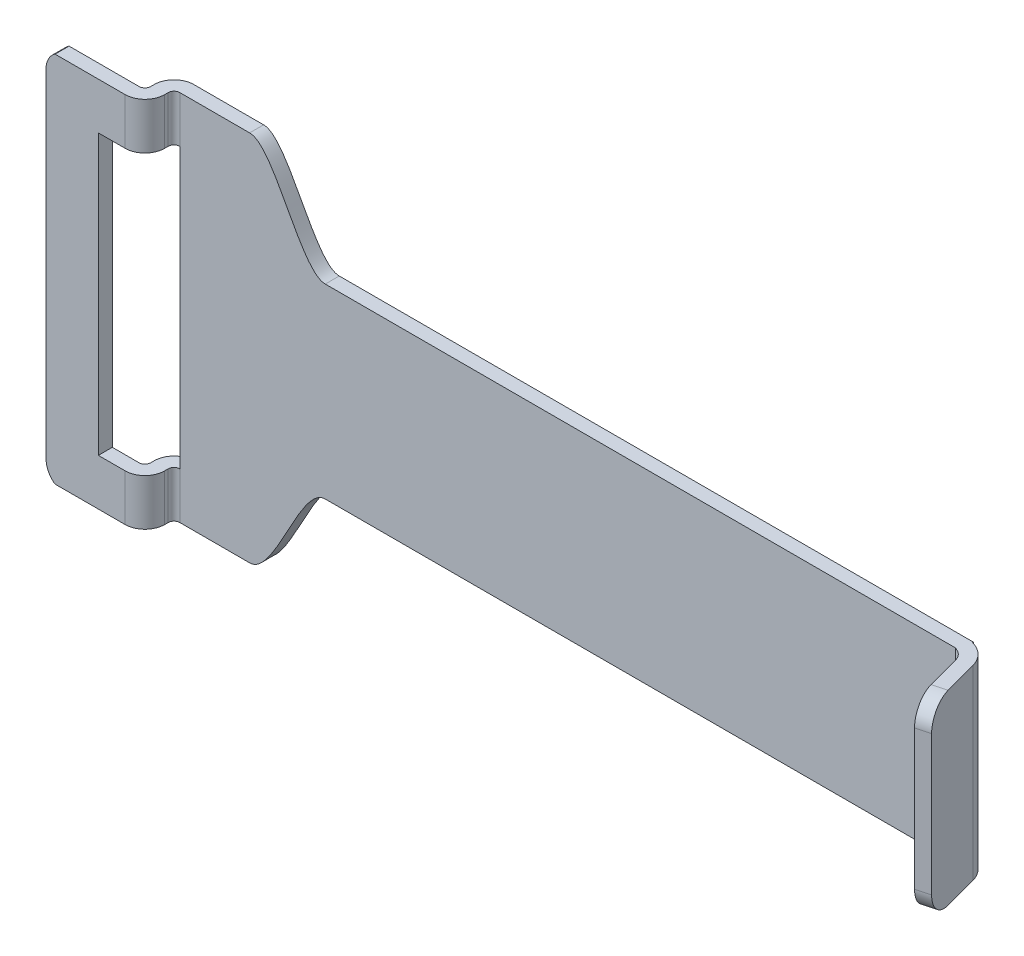
from build123d import *

# Parameters (mm, degrees)
EXTRUDE_1_2_DEPTH    = 1.2
EXTRUDE_16_DEPTH     = 16
EXTRUDE_32_DEPTH     = 32
SKETCH_24_138_5_W    = 4.5
SKETCH_24_138_5_H    = 24
CUT_EXTRUDE_24_DEPTH = 20
EXTRUDE_884_DEPTH    = 1.2
FILLET_R2_R          = 2


with BuildPart() as part:
    # 草图_平板外形_总宽32_舌宽16_对称过渡 → 拉伸_板厚1点2 (new body)
    with BuildSketch(Plane.XY.offset(-306.8)):
        with BuildLine():
            Line((-3.5, 122.5), (2.5, 122.5))
            add(Edge.make_bspline(
                [(2.5, 122.5), (2.568251017, 122.504680022), (2.707904652, 122.514256172), (2.913789315, 122.58691144), (3.117968932, 122.696636373), (3.321081083, 122.844952736), (3.523655529, 123.027402997), (3.725998426, 123.241623536), (3.928269446, 123.484685473), (4.130543205, 123.753813901), (4.33285106, 124.046152711), (4.53520279, 124.358837958), (4.737597952, 124.688983876), (4.940031434, 125.033693923), (5.142496177, 125.390062896), (5.344984435, 125.755180133), (5.547488324, 126.126131323), (5.75, 126.5), (5.952511676, 126.873868677), (6.155015565, 127.244819867), (6.357503823, 127.609937104), (6.559968566, 127.966306077), (6.762402048, 128.311016124), (6.96479721, 128.641162042), (7.16714894, 128.953847289), (7.369456795, 129.246186099), (7.571730554, 129.515314527), (7.774001574, 129.758376464), (7.976344471, 129.972597003), (8.178918917, 130.155047264), (8.382031068, 130.303363627), (8.586210685, 130.41308856), (8.792095348, 130.485743828), (8.931748983, 130.495319978), (9, 130.5)],
                knots=[0, 0, 0, 0, 0.019229913, 0.039347798, 0.060985216, 0.084517213, 0.110120649, 0.137834401, 0.167605027, 0.199317689, 0.232816328, 0.26791678, 0.304415434, 0.342095061, 0.380728864, 0.420083383, 0.459920669, 0.5, 0.540079331, 0.579916617, 0.619271136, 0.657904939, 0.695584566, 0.73208322, 0.767183672, 0.800682311, 0.832394973, 0.862165599, 0.889879351, 0.915482787, 0.939014784, 0.960652202, 0.980770087, 1, 1, 1, 1], degree=3))
            Line((9, 130.5), (63.2, 130.5))
            Line((63.2, 130.5), (63.2, 146.5))
            Line((63.2, 146.5), (9, 146.5))
            add(Edge.make_bspline(
                [(2.5, 154.5), (2.568251017, 154.495319978), (2.707904652, 154.485743828), (2.913789315, 154.41308856), (3.117968932, 154.303363627), (3.321081083, 154.155047264), (3.523655529, 153.972597003), (3.725998426, 153.758376464), (3.928269446, 153.515314527), (4.130543205, 153.246186099), (4.33285106, 152.953847289), (4.53520279, 152.641162042), (4.737597952, 152.311016124), (4.940031434, 151.966306077), (5.142496177, 151.609937104), (5.344984435, 151.244819867), (5.547488324, 150.873868677), (5.75, 150.5), (5.952511676, 150.126131323), (6.155015565, 149.755180133), (6.357503823, 149.390062896), (6.559968566, 149.033693923), (6.762402048, 148.688983876), (6.96479721, 148.358837958), (7.16714894, 148.046152711), (7.369456795, 147.753813901), (7.571730554, 147.484685473), (7.774001574, 147.241623536), (7.976344471, 147.027402997), (8.178918917, 146.844952736), (8.382031068, 146.696636373), (8.586210685, 146.58691144), (8.792095348, 146.514256172), (8.931748983, 146.504680022), (9, 146.5)],
                knots=[0, 0, 0, 0, 0.019229913, 0.039347798, 0.060985216, 0.084517213, 0.110120649, 0.137834401, 0.167605027, 0.199317689, 0.232816328, 0.26791678, 0.304415434, 0.342095061, 0.380728864, 0.420083383, 0.459920669, 0.5, 0.540079331, 0.579916617, 0.619271136, 0.657904939, 0.695584566, 0.73208322, 0.767183672, 0.800682311, 0.832394973, 0.862165599, 0.889879351, 0.915482787, 0.939014784, 0.960652202, 0.980770087, 1, 1, 1, 1], degree=3))
            Line((2.5, 154.5), (-3.5, 154.5))
            Line((-3.5, 154.5), (-3.5, 122.5))
        make_face()
    extrude(amount=EXTRUDE_1_2_DEPTH)

    # Sketch 429 → 拉伸_舌宽16 (add)
    with BuildSketch(Plane(origin=(0, 130.5, 0), x_dir=(1, 0, 0), z_dir=(0, 1, 0))):
        with BuildLine():
            Line((9, 306.8), (63.5, 306.8))
            Line((63.5, 306.8), (63.5, 306.723790008))
            ThreePointArc((63.5, 306.723790008), (64.58930082, 306.104776448), (65.218221983, 305.021165708))
            Line((65.218221983, 305.021165708), (66.512317209, 300.191536577))
            Line((66.512317209, 300.191536577), (65.353206217, 299.880953723))
            Line((65.353206217, 299.880953723), (64.059110992, 304.710582854))
            ThreePointArc((64.059110992, 304.710582854), (63.74465041, 305.252388224), (63.2, 305.561895004))
            Line((63.2, 305.561895004), (63.2, 305.6))
            Line((63.2, 305.6), (9, 305.6))
            Line((9, 305.6), (9, 306.8))
        make_face()
    extrude(amount=EXTRUDE_16_DEPTH)

    # Sketch 524 → 拉伸_头部总宽32 (add)
    with BuildSketch(Plane(origin=(0, 122.5, 0), x_dir=(1, 0, 0), z_dir=(0, 1, 0))):
        with BuildLine():
            Line((-5.7, 304.3), (-11.71944631, 304.3))
            Line((-11.71944631, 304.3), (-11.71944631, 303.1))
            Line((-11.71944631, 303.1), (-5.7, 303.1))
            ThreePointArc((-5.7, 303.1), (-4.497918472, 303.597918472), (-4, 304.8))
            Line((-4, 304.8), (-4, 305.1))
            ThreePointArc((-4, 305.1), (-3.853553391, 305.453553391), (-3.5, 305.6))
            Line((-3.5, 305.6), (2.5, 305.6))
            Line((2.5, 305.6), (2.5, 306.8))
            Line((2.5, 306.8), (-3.5, 306.8))
            ThreePointArc((-3.5, 306.8), (-4.702081528, 306.302081528), (-5.2, 305.1))
            Line((-5.2, 305.1), (-5.2, 304.8))
            ThreePointArc((-5.2, 304.8), (-5.346446609, 304.446446609), (-5.7, 304.3))
        make_face()
    extrude(amount=EXTRUDE_32_DEPTH)

    # 草图_榫槽净宽24_中线138点5 → 切除_榫槽24 (cut)
    with BuildSketch(Plane.XY.offset(-299)):
        with Locations((-5.75, 138.5)):
            Rectangle(SKETCH_24_138_5_W, SKETCH_24_138_5_H)
    extrude(amount=-CUT_EXTRUDE_24_DEPTH, mode=Mode.SUBTRACT)

    # 草图_头部完整外形_总宽32_槽24 → Extrude 884 (add)
    with BuildSketch(Plane.XY.offset(-304.3)):
        with BuildLine():
            Line((-5.7, 154.5), (-5.7, 150.5))
            Line((-5.7, 150.5), (-8, 150.5))
            Line((-8, 150.5), (-8, 126.5))
            Line((-8, 126.5), (-5.7, 126.5))
            Line((-5.7, 126.5), (-5.7, 122.5))
            Line((-5.7, 122.5), (-11.71944631, 122.5))
            add(Edge.make_bspline(
                [(-12.5, 124.034562212), (-12.499938159, 124.023029786), (-12.499814468, 123.999963286), (-12.498936319, 123.965367365), (-12.497443181, 123.93078278), (-12.495403218, 123.896208954), (-12.492747447, 123.861654709), (-12.489510446, 123.827122022), (-12.485676021, 123.792616625), (-12.481245518, 123.758142921), (-12.476215317, 123.723705745), (-12.47058192, 123.689310059), (-12.464341601, 123.654960897), (-12.457490017, 123.620663481), (-12.450022451, 123.586423185), (-12.441933692, 123.552245581), (-12.433218056, 123.518136449), (-12.423869366, 123.484101803), (-12.413880931, 123.450147918), (-12.403245533, 123.416281356), (-12.391955405, 123.382508994), (-12.380002212, 123.348838059), (-12.367377024, 123.31527616), (-12.354070301, 123.281831329), (-12.340071858, 123.248512061), (-12.325370845, 123.215327364), (-12.309955716, 123.182286805), (-12.293814204, 123.149400568), (-12.276933286, 123.116679519), (-12.259299156, 123.08413527), (-12.240897191, 123.05178026), (-12.221711924, 123.019627836), (-12.201727007, 122.987692349), (-12.180925191, 122.955989258), (-12.159288292, 122.92453525), (-12.136797175, 122.893348363), (-12.113431735, 122.862448139), (-12.089170893, 122.831855779), (-12.063992595, 122.801594323), (-12.037873835, 122.771688857), (-12.010790698, 122.742166721), (-11.982718406, 122.713057784), (-11.953631496, 122.684394601), (-11.923503642, 122.656213171), (-11.892309147, 122.628551369), (-11.860018463, 122.601456324), (-11.826614179, 122.574961378), (-11.792043997, 122.549159388), (-11.756366816, 122.523975845), (-11.731804684, 122.508025417), (-11.71944631, 122.5)],
                knots=[0, 0, 0, 0, 0.019280259, 0.038563274, 0.057853041, 0.077151606, 0.096462833, 0.115789535, 0.135134996, 0.15450244, 0.173895129, 0.193316406, 0.212769662, 0.232258368, 0.251786071, 0.271356411, 0.290973123, 0.310640051, 0.330361155, 0.350140527, 0.369982395, 0.389891141, 0.409871307, 0.429927615, 0.450064974, 0.4702885, 0.490603526, 0.511015624, 0.531530615, 0.552154592, 0.572893933, 0.593755326, 0.61474578, 0.635872653, 0.657143665, 0.678566916, 0.700150912, 0.721904572, 0.743837244, 0.765958718, 0.788279226, 0.81080944, 0.83356046, 0.856543784, 0.879771256, 0.903255123, 0.927007303, 0.951041228, 0.97536652, 1, 1, 1, 1], degree=3))
            Line((-12.5, 124.034562212), (-12.5, 152.965437788))
            add(Edge.make_bspline(
                [(-11.71944631, 154.5), (-11.731804684, 154.491974583), (-11.756366816, 154.476024155), (-11.792043997, 154.450840612), (-11.826614179, 154.425038622), (-11.860018463, 154.398543676), (-11.892309147, 154.371448631), (-11.923503642, 154.343786829), (-11.953631496, 154.315605399), (-11.982718406, 154.286942216), (-12.010790698, 154.257833279), (-12.037873835, 154.228311143), (-12.063992595, 154.198405677), (-12.089170893, 154.168144221), (-12.113431735, 154.137551861), (-12.136797175, 154.106651637), (-12.159288292, 154.07546475), (-12.180925191, 154.044010742), (-12.201727007, 154.012307651), (-12.221711924, 153.980372164), (-12.240897191, 153.94821974), (-12.259299156, 153.91586473), (-12.276933286, 153.883320481), (-12.293814204, 153.850599432), (-12.309955716, 153.817713195), (-12.325370845, 153.784672636), (-12.340071858, 153.751487939), (-12.354070301, 153.718168671), (-12.367377024, 153.68472384), (-12.380002212, 153.651161941), (-12.391955405, 153.617491006), (-12.403245533, 153.583718644), (-12.413880931, 153.549852082), (-12.423869366, 153.515898197), (-12.433218056, 153.481863551), (-12.441933692, 153.447754419), (-12.450022451, 153.413576815), (-12.457490017, 153.379336519), (-12.464341601, 153.345039103), (-12.47058192, 153.310689941), (-12.476215317, 153.276294255), (-12.481245518, 153.241857079), (-12.485676021, 153.207383375), (-12.489510446, 153.172877978), (-12.492747447, 153.138345291), (-12.495403218, 153.103791046), (-12.497443181, 153.06921722), (-12.498936319, 153.034632635), (-12.499814468, 153.000036714), (-12.499938159, 152.976970214), (-12.5, 152.965437788)],
                knots=[0, 0, 0, 0, 0.02463348, 0.048958772, 0.072992697, 0.096744877, 0.120228744, 0.143456216, 0.16643954, 0.18919056, 0.211720774, 0.234041282, 0.256162756, 0.278095428, 0.299849088, 0.321433084, 0.342856335, 0.364127347, 0.38525422, 0.406244674, 0.427106067, 0.447845408, 0.468469385, 0.488984376, 0.509396474, 0.5297115, 0.549935026, 0.570072385, 0.590128693, 0.610108859, 0.630017605, 0.649859473, 0.669638845, 0.689359949, 0.709026877, 0.728643589, 0.748213929, 0.767741632, 0.787230338, 0.806683594, 0.826104871, 0.84549756, 0.864865004, 0.884210465, 0.903537167, 0.922848394, 0.942146959, 0.961436726, 0.980719741, 1, 1, 1, 1], degree=3))
            Line((-11.71944631, 154.5), (-5.7, 154.5))
        make_face()
    extrude(amount=EXTRUDE_884_DEPTH)

    # 圆角_舌片上下端角_R2
    fillet_r2_edges = [part.edges().sort_by_distance(p)[0] for p in [
        (65.932761713, 146.5, -300.03624515),
        (65.932761713, 130.5, -300.03624515),
    ]]
    fillet(fillet_r2_edges, radius=FILLET_R2_R)


solid = part.part
